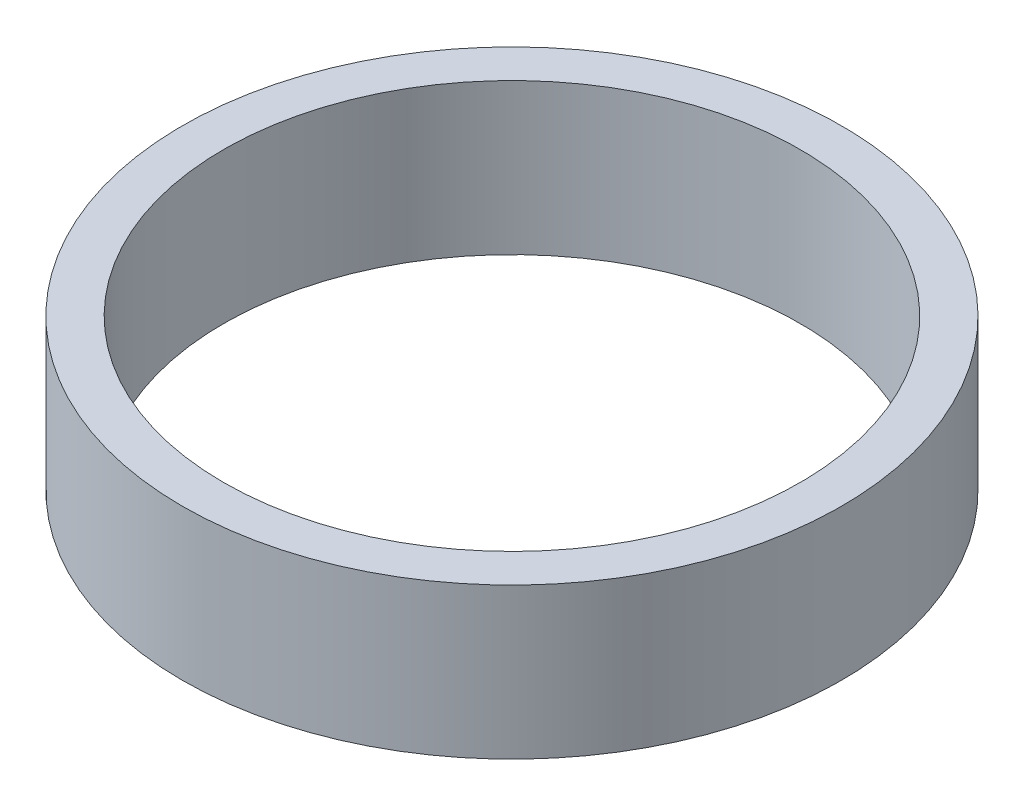
from build123d import *

# Parameters (mm, degrees)
SKETCH_1_R      = 40
SKETCH_1_R_2    = 35
EXTRUDE_1_DEPTH = 18.3


with BuildPart() as part:
    # Эскиз1 → Бобышка-Вытянуть1 (new body)
    with BuildSketch(Plane(origin=(0, 0, 0), x_dir=(1, 0, 0), z_dir=(0, 1, 0))):
        with Locations(Location((0, 0, 0), (0, 0, 270))):
            Circle(SKETCH_1_R)
        with Locations(Location((0, 0, 0), (0, 0, 270))):
            Circle(SKETCH_1_R_2, mode=Mode.SUBTRACT)
    extrude(amount=EXTRUDE_1_DEPTH)


solid = part.part
